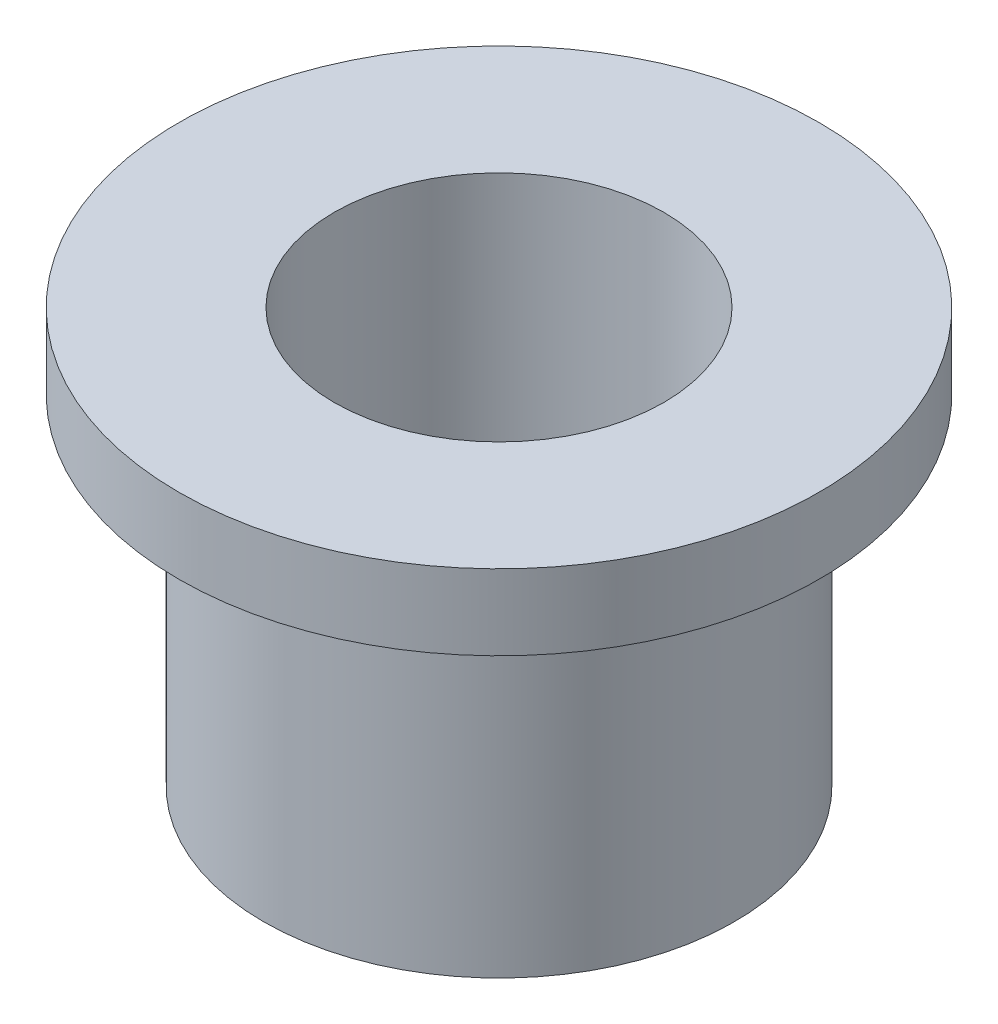
from build123d import *


with BuildPart() as part:
    # Sketch1 → Revolve1 (revolve)
    with BuildSketch(Plane.XY, mode=Mode.PRIVATE) as revolve1_sk:
        Polygon((34, 0), (17.5, 0), (17.5, -44), (25, -44), (25, -8), (34, -8), align=None)
    revolve(revolve1_sk.sketch.rotate(Axis((0, 24.157894737, 0), (0, -1, 0)), 90), axis=Axis((0, 24.157894737, 0), (0, -1, 0)))


solid = part.part
